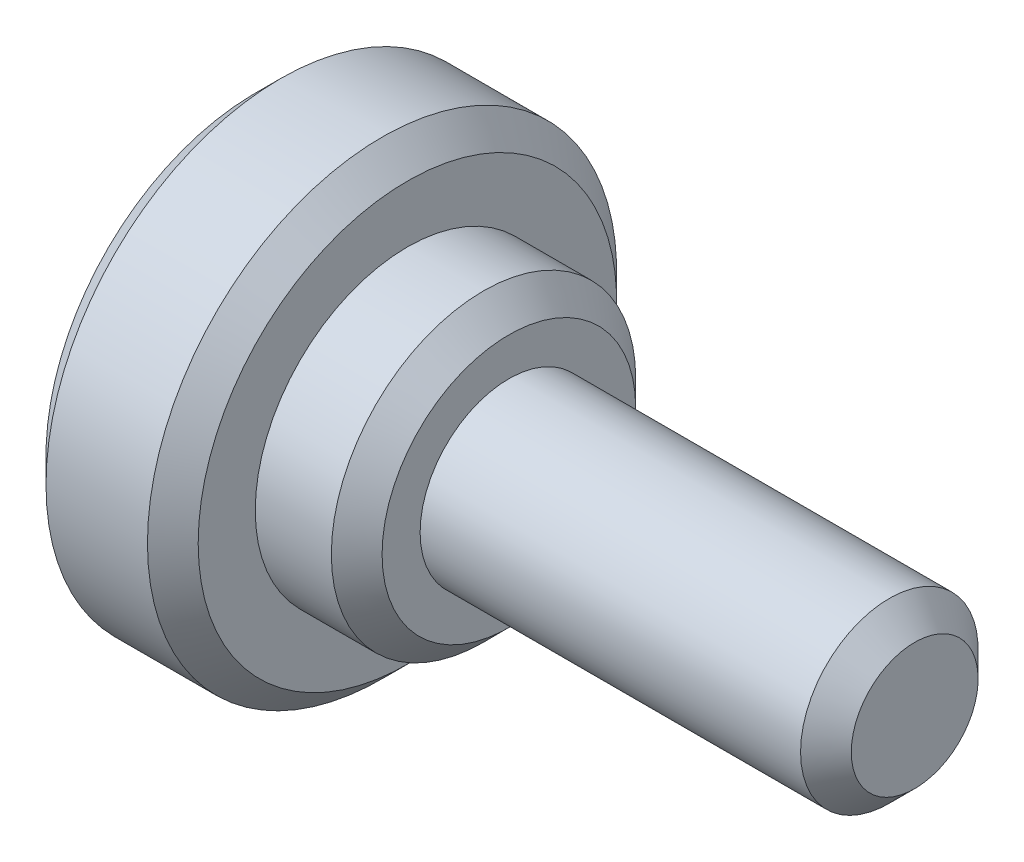
from build123d import *

# Parameters (mm, degrees)
CHAMFER_1_SIZE = 1


with BuildPart() as part:
    # Эскиз1 → Повернуть1 (revolve)
    with BuildSketch(Plane.XY, mode=Mode.PRIVATE) as revolve_1_sk:
        Polygon((1.5, 8.25), (4, 8.25), (4, 2.5), (6, 2.5), (7.443375673, 0), (26, 0), (26, 3.5), (10, 3.5), (10, 6), (6, 6), (6, 9.25), (0, 9.25), (0, 7), (1.5, 7), align=None)
    revolve(revolve_1_sk.sketch.rotate(Axis((0, 0, 0), (1, 0, 0)), 90), axis=Axis((0, 0, 0), (1, 0, 0)))

    # Фаска1
    chamfer_1_edges = [part.edges().sort_by_distance(p)[0] for p in [
        (0, 0, -9.25),
        (6, 0, -9.25),
        (10, 0, -6),
        (26, 0, -3.5),
    ]]
    chamfer(chamfer_1_edges, length=CHAMFER_1_SIZE)


solid = part.part
